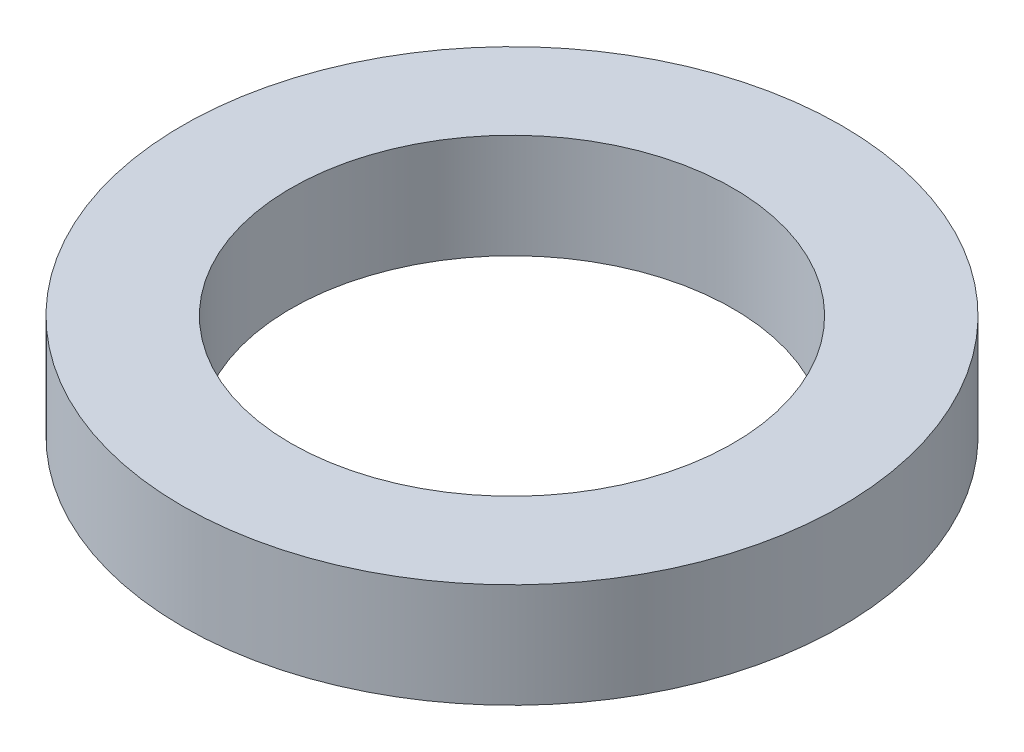
from build123d import *

# Parameters (mm, degrees)
SKETCH1_W = 1.975
SKETCH1_H = 1.9


with BuildPart() as part:
    # Sketch1 → Revolve1 (revolve)
    with BuildSketch(Plane(origin=(0, 0, 0), x_dir=(-1, 0, 0), z_dir=(0, 0, -1)), mode=Mode.PRIVATE) as revolve1_sk:
        with Locations((-5.0125, 0.95)):
            Rectangle(SKETCH1_W, SKETCH1_H)
    revolve(revolve1_sk.sketch.rotate(Axis((0, 0, 0), (0, 1, 0)), 270), axis=Axis((0, 0, 0), (0, 1, 0)))


solid = part.part
